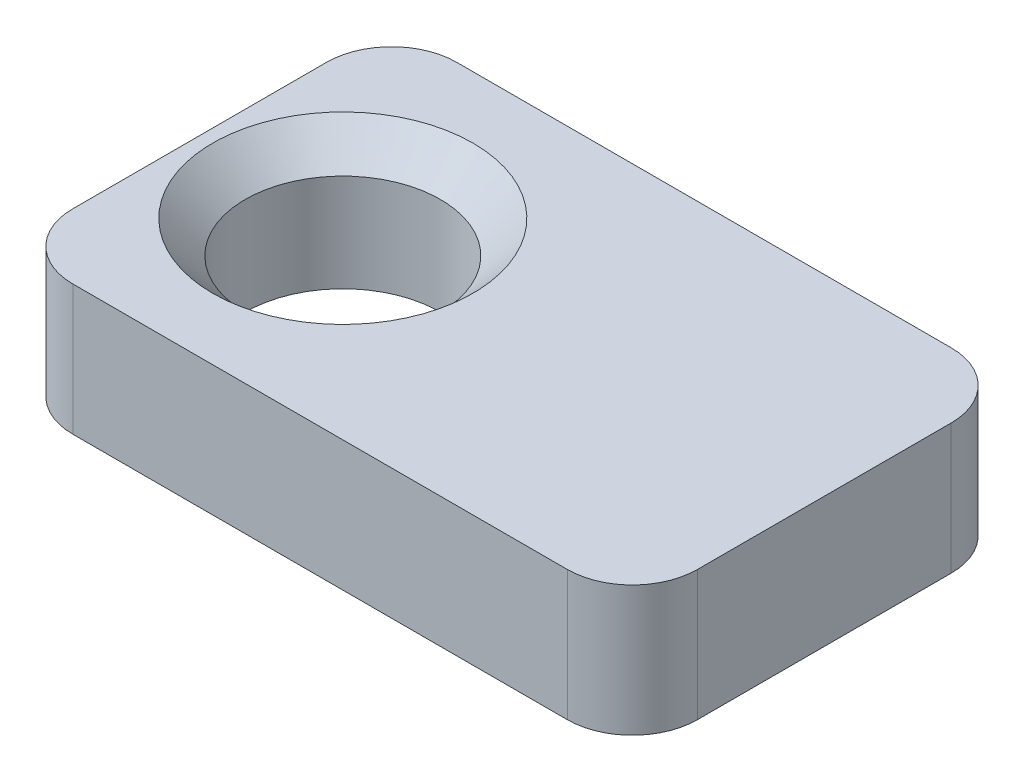
from build123d import *

# Parameters (mm, degrees)
SKETCH1_W                                       = 4.8
SKETCH1_H                                       = 2.95
BOSS_EXTRUDE1_DEPTH                             = 1
CSK_FOR_M2_FLAT_HEAD_MACHINE_SCREW1_D           = 1.5
CSK_FOR_M2_FLAT_HEAD_MACHINE_SCREW1_CSINK_D     = 2
CSK_FOR_M2_FLAT_HEAD_MACHINE_SCREW1_CSINK_ANGLE = 90
FILLET1_R                                       = 0.5


with BuildPart() as part:
    # Sketch1 → Boss-Extrude1 (new body)
    with BuildSketch(Plane(origin=(0, 0, 0), x_dir=(1, 0, 0), z_dir=(0, 1, 0))):
        with Locations((2.4, 1.475)):
            Rectangle(SKETCH1_W, SKETCH1_H)
    extrude(amount=BOSS_EXTRUDE1_DEPTH)

    # CSK for M2 Flat Head Machine Screw1 (through all)
    with Locations(Plane(origin=(1.1, 1, -1.475), x_dir=(0, 0, 1), z_dir=(0, 1, 0))):
        with Locations((0, 0)):
            CounterSinkHole(CSK_FOR_M2_FLAT_HEAD_MACHINE_SCREW1_D / 2, CSK_FOR_M2_FLAT_HEAD_MACHINE_SCREW1_CSINK_D / 2, counter_sink_angle=CSK_FOR_M2_FLAT_HEAD_MACHINE_SCREW1_CSINK_ANGLE)

    # Fillet1
    fillet1_edges = [part.edges().sort_by_distance(p)[0] for p in [
        (0, 0.5, -2.95),
        (4.8, 0.5, -2.95),
        (4.8, 0.5, 0),
        (0, 0.5, 0),
    ]]
    fillet(fillet1_edges, radius=FILLET1_R)


solid = part.part
